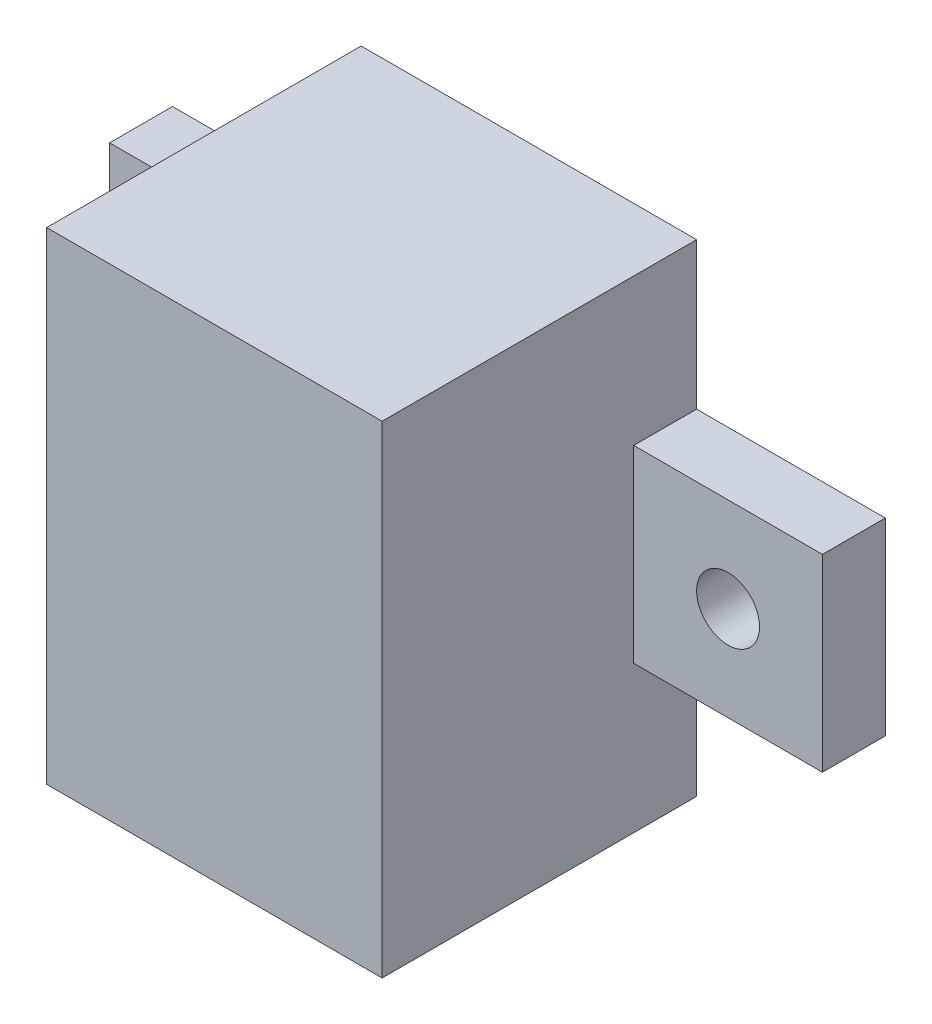
from build123d import *

# Parameters (mm, degrees)
SKETCH1_W           = 9
SKETCH1_H           = 9
SKETCH1_R           = 1.5
SKETCH1_W_2         = 16
SKETCH1_H_2         = 23
BOSS_EXTRUDE1_DEPTH = 15
SKETCH2_W           = 10
SKETCH2_H           = 10
SKETCH2_W_2         = 8.5
SKETCH2_H_2         = 2
SKETCH2_W_3         = 9
SKETCH2_H_3         = 12
CUT_EXTRUDE1_DEPTH  = 20


with BuildPart() as part:
    # Sketch1 → Boss-Extrude1 (new body)
    # profile 1 of 3: a face of its own
    with BuildSketch(Plane.XY):
        with Locations((-12.5, 0)):
            Rectangle(SKETCH1_W, SKETCH1_H)
        with Locations((-12.5, 0)):
            Circle(SKETCH1_R, mode=Mode.SUBTRACT)
    # profile 2 of 3: a face of its own
    with BuildSketch(Plane.XY):
        Rectangle(SKETCH1_W_2, SKETCH1_H_2)
    # profile 3 of 3: a face of its own
    with BuildSketch(Plane.XY):
        with Locations((12.5, 0)):
            Rectangle(SKETCH1_W, SKETCH1_H)
        with Locations((12.5, 0)):
            Circle(SKETCH1_R, mode=Mode.SUBTRACT)
    extrude(amount=BOSS_EXTRUDE1_DEPTH)

    # Sketch2 → Cut-Extrude1 (cut)
    with BuildSketch(Plane.XZ.offset(11.5)):
        with Locations((0, 7)):
            Rectangle(SKETCH2_W, SKETCH2_H)
        with Locations((0, 1)):
            Rectangle(SKETCH2_W_2, SKETCH2_H_2)
        with Locations((12.5, 9)):
            Rectangle(SKETCH2_W_3, SKETCH2_H_3)
        with Locations((-12.5, 9)):
            Rectangle(SKETCH2_W_3, SKETCH2_H_3)
    extrude(amount=-CUT_EXTRUDE1_DEPTH, mode=Mode.SUBTRACT)


solid = part.part
